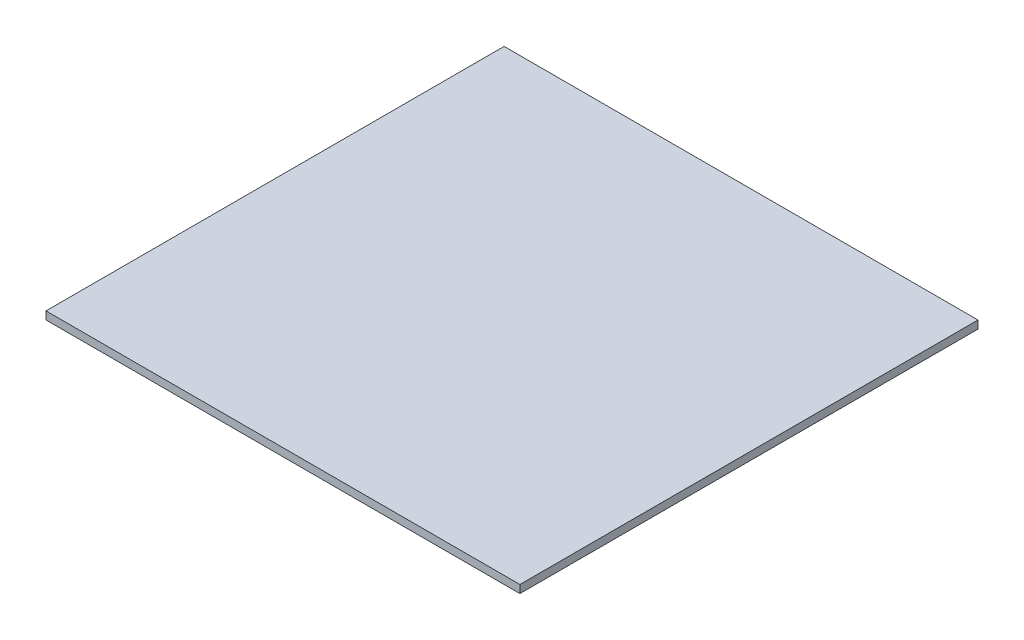
from build123d import *

# Parameters (mm, degrees)
SKETCH1_W           = 762
SKETCH1_H           = 736.6
BOSS_EXTRUDE1_DEPTH = 12.7


with BuildPart() as part:
    # Sketch1 → Boss-Extrude1 (new body)
    with BuildSketch(Plane(origin=(0, 0, 0), x_dir=(1, 0, 0), z_dir=(0, 1, 0))):
        with Locations((381, 368.3)):
            Rectangle(SKETCH1_W, SKETCH1_H)
    extrude(amount=BOSS_EXTRUDE1_DEPTH)


solid = part.part
